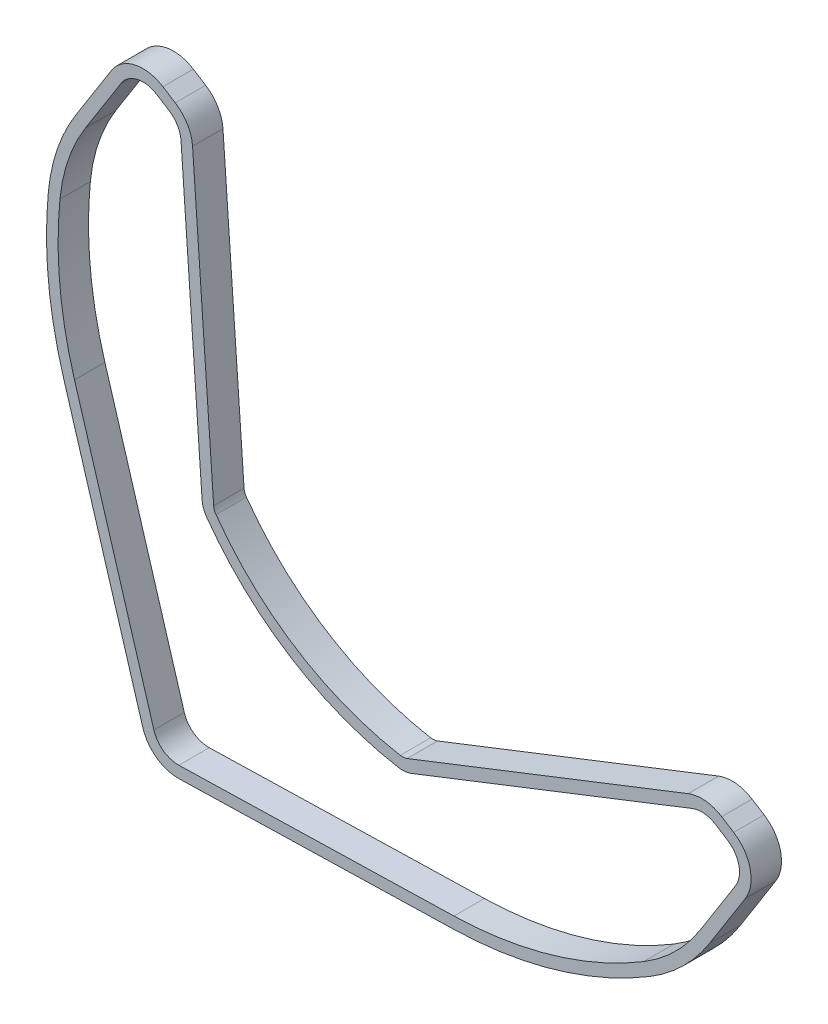
from build123d import *

# Parameters (mm, degrees)
BOSS_EXTRUDE1_DEPTH = 3


with BuildPart() as part:
    # Sketch1 → Boss-Extrude1 (new body)
    with BuildSketch(Plane.XY):
        with BuildLine():
            Line((-176.261287631, -146.790125913), (-174.178854352, -176.465678255))
            ThreePointArc((-174.178854352, -176.465678255), (-174.10743246, -176.805459554), (-173.946658522, -177.113199961))
            ThreePointArc((-173.946658522, -177.113199961), (-165.987154225, -184.643491087), (-155.766014333, -188.591565607))
            ThreePointArc((-155.766014333, -188.591565607), (-155.419681283, -188.604453413), (-155.08275986, -188.523233763))
            Line((-155.08275986, -188.523233763), (-127.359223318, -177.660950501))
            ThreePointArc((-127.359223318, -177.660950501), (-125.666782112, -177.423691901), (-124.049456606, -177.975875826))
            Line((-124.049456606, -177.975875826), (-122.862735706, -178.725113106))
            ThreePointArc((-122.862735706, -178.725113106), (-121.236507239, -181.027562815), (-121.714667864, -183.805557795))
            Line((-121.714667864, -183.805557795), (-125.240247105, -189.389741443))
            ThreePointArc((-125.240247105, -189.389741443), (-127.862246775, -192.636349191), (-131.161557479, -195.191714728))
            ThreePointArc((-131.161557479, -195.191714728), (-140.433747596, -199.259536064), (-150.43809188, -200.819592292))
            Line((-150.43809188, -200.819592292), (-177.583691953, -201.507185822))
            ThreePointArc((-177.583691953, -201.507185822), (-179.816644976, -200.815129336), (-181.172145987, -198.910493309))
            Line((-181.172145987, -198.910493309), (-189.006171765, -172.910792767))
            ThreePointArc((-189.006171765, -172.910792767), (-190.489642304, -165.396715762), (-190.485324726, -157.737602274))
            ThreePointArc((-190.485324726, -157.737602274), (-189.596958817, -153.660084628), (-187.793276628, -149.89683142))
            Line((-187.793276628, -149.89683142), (-184.267697387, -144.312647772))
            ThreePointArc((-184.267697387, -144.312647772), (-181.965247678, -142.686419305), (-179.187252699, -143.16457993))
            Line((-179.187252699, -143.16457993), (-177.969064462, -143.933684141))
            ThreePointArc((-177.969064462, -143.933684141), (-176.774137848, -145.158008999), (-176.261287631, -146.790125913))
        make_face()
        with BuildLine():
            Line((-177.401483744, -146.870137307), (-175.319050465, -176.54568965))
            ThreePointArc((-175.319050465, -176.54568965), (-175.183348871, -177.191274117), (-174.877878388, -177.775980891))
            ThreePointArc((-174.877878388, -177.775980891), (-166.597350632, -185.60998441), (-155.963970787, -189.717293035))
            ThreePointArc((-155.963970787, -189.717293035), (-155.305937992, -189.741779868), (-154.665787288, -189.587462533))
            Line((-154.665787288, -189.587462533), (-126.942250746, -178.72517927))
            ThreePointArc((-126.942250746, -178.72517927), (-125.775049914, -178.56155265), (-124.659653013, -178.94236915))
            Line((-124.659653013, -178.94236915), (-123.472932113, -179.69160643))
            ThreePointArc((-123.472932113, -179.69160643), (-122.351395239, -181.279502781), (-122.681161188, -183.195361388))
            Line((-122.681161188, -183.195361388), (-126.206740429, -188.779545035))
            ThreePointArc((-126.206740429, -188.779545035), (-128.66220108, -191.819941137), (-131.751952653, -194.21299999))
            ThreePointArc((-131.751952653, -194.21299999), (-140.75407898, -198.162341093), (-150.467034596, -199.67695879))
            Line((-150.467034596, -199.67695879), (-177.612634669, -200.36455232))
            ThreePointArc((-177.612634669, -200.36455232), (-179.146576312, -199.889139604), (-180.077746571, -198.580737463))
            Line((-180.077746571, -198.580737463), (-187.911772349, -172.581036921))
            ThreePointArc((-187.911772349, -172.581036921), (-189.352035008, -165.285816528), (-189.347843185, -157.849784016))
            ThreePointArc((-189.347843185, -157.849784016), (-188.515902755, -154.031254117), (-186.826783305, -150.507027827))
            Line((-186.826783305, -150.507027827), (-183.301204063, -144.922844179))
            ThreePointArc((-183.301204063, -144.922844179), (-181.713307713, -143.801307305), (-179.797449106, -144.131073254))
            Line((-179.797449106, -144.131073254), (-178.579260869, -144.900177465))
            ThreePointArc((-178.579260869, -144.900177465), (-177.755173549, -145.744539435), (-177.401483744, -146.870137307))
        make_face(mode=Mode.SUBTRACT)
    extrude(amount=BOSS_EXTRUDE1_DEPTH)


solid = part.part
